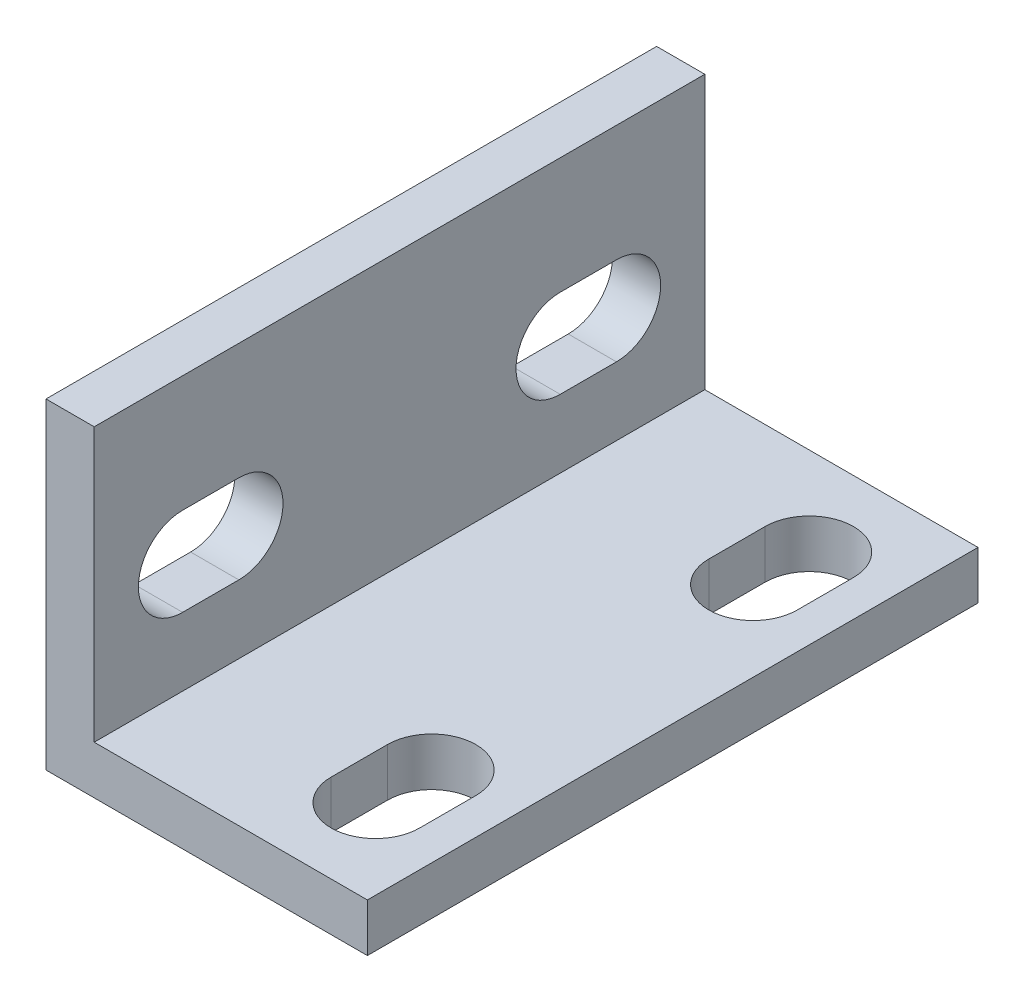
from build123d import *

# Parameters (mm, degrees)
SKETCH1_W           = 20
SKETCH1_H           = 38
BOSS_EXTRUDE1_DEPTH = 20
SKETCH2_W           = 17
SKETCH2_H           = 17
CUT_EXTRUDE1_DEPTH  = 45.09081537
CUT_EXTRUDE2_DEPTH  = 28.386127875
CUT_EXTRUDE3_DEPTH  = 33.403703492


with BuildPart() as part:
    # Sketch1 → Boss-Extrude1 (new body)
    with BuildSketch(Plane(origin=(0, 0, 0), x_dir=(1, 0, 0), z_dir=(0, 1, 0))):
        Rectangle(SKETCH1_W, SKETCH1_H)
    extrude(amount=BOSS_EXTRUDE1_DEPTH)

    # Sketch2 → Cut-Extrude1 (cut, through all)
    with BuildSketch(Plane.XY.offset(19)):
        with Locations((1.5, 11.5)):
            Rectangle(SKETCH2_W, SKETCH2_H)
    extrude(amount=-CUT_EXTRUDE1_DEPTH, mode=Mode.SUBTRACT)

    # Sketch3 → Cut-Extrude2 (cut, through all)
    with BuildSketch(Plane(origin=(0, 3, 0), x_dir=(1, 0, 0), z_dir=(0, 1, 0))):
        with BuildLine():
            Line((7.75, -10), (7.75, -13.5))
            ThreePointArc((7.75, -13.5), (5, -16.25), (2.25, -13.5))
            Line((2.25, -13.5), (2.25, -10))
            ThreePointArc((2.25, -10), (5, -7.25), (7.75, -10))
        make_face()
        with BuildLine():
            Line((7.75, 10), (7.75, 13.5))
            ThreePointArc((7.75, 13.5), (5, 16.25), (2.25, 13.5))
            Line((2.25, 13.5), (2.25, 10))
            ThreePointArc((2.25, 10), (5, 7.25), (7.75, 10))
        make_face()
    extrude(amount=-CUT_EXTRUDE2_DEPTH, mode=Mode.SUBTRACT)

    # Sketch4 → Cut-Extrude3 (cut, through all)
    with BuildSketch(Plane(origin=(-7, 0, 0), x_dir=(0, 0, -1), z_dir=(1, 0, 0))):
        with BuildLine():
            Line((-13.5, 12.75), (-10, 12.75))
            ThreePointArc((-10, 12.75), (-7.25, 10), (-10, 7.25))
            Line((-10, 7.25), (-13.5, 7.25))
            ThreePointArc((-13.5, 7.25), (-16.25, 10), (-13.5, 12.75))
        make_face()
        with BuildLine():
            Line((13.5, 12.75), (10, 12.75))
            ThreePointArc((10, 12.75), (7.25, 10), (10, 7.25))
            Line((10, 7.25), (13.5, 7.25))
            ThreePointArc((13.5, 7.25), (16.25, 10), (13.5, 12.75))
        make_face()
    extrude(amount=-CUT_EXTRUDE3_DEPTH, mode=Mode.SUBTRACT)


solid = part.part
